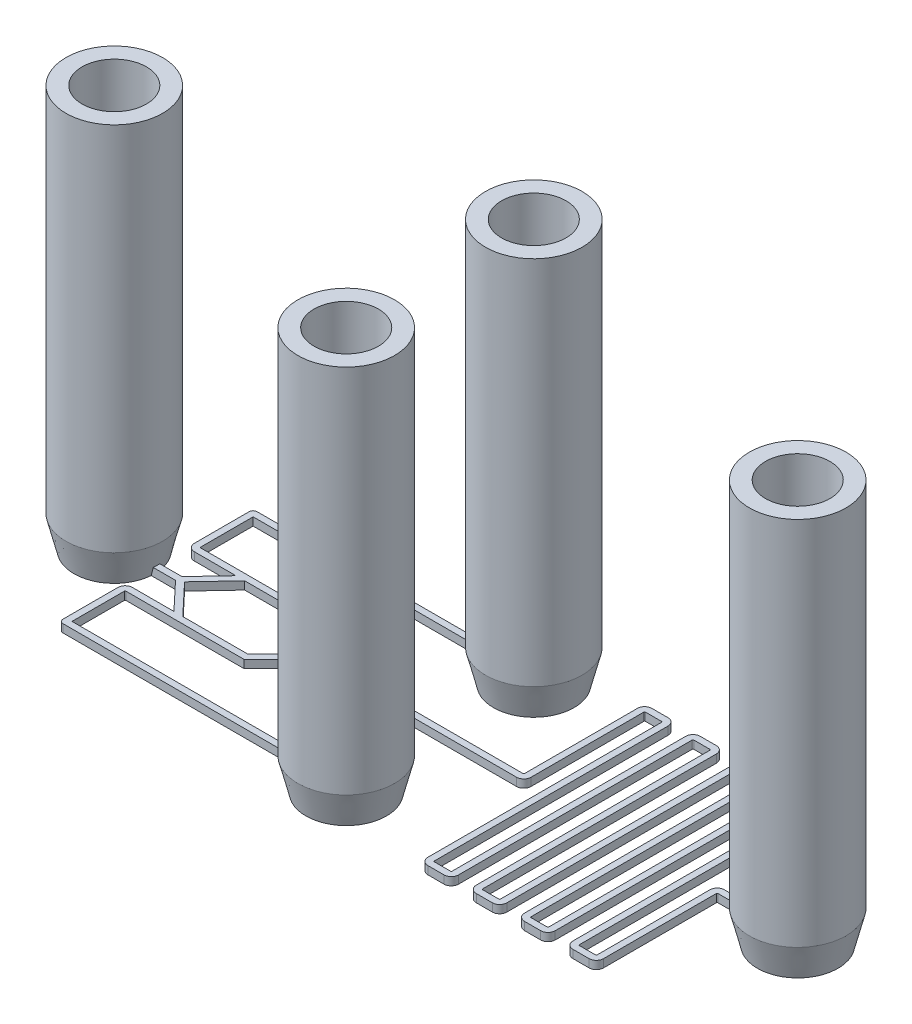
from build123d import *

# Parameters (mm, degrees)
SKELTON_EXTRU_DEPTH = 1
SKETCH8_R           = 4
CUT_EXTRUDE1_DEPTH  = 45


with BuildPart() as part:
    # Sketch2 → skelton_extru (new body)
    with BuildSketch(Plane(origin=(0, 0, 0), x_dir=(1, 0, 0), z_dir=(0, 1, 0))):
        with BuildLine():
            Line((-31.842640687, 11.242640687), (2.6, 11.242640687))
            ThreePointArc((2.6, 11.242640687), (3, 11.642640687), (2.6, 12.042640687))
            Line((2.6, 12.042640687), (-31.842640687, 12.042640687))
            Line((-31.842640687, 12.042640687), (-32.142640687, 12.042640687))
            ThreePointArc((-32.142640687, 12.042640687), (-32.496194078, 11.896194078), (-32.642640687, 11.542640687))
            Line((-32.642640687, 11.542640687), (-32.642640687, 4.742640687))
            ThreePointArc((-32.642640687, 4.742640687), (-32.37903679, 4.106244584), (-31.742640687, 3.842640687))
            Line((-31.742640687, 3.842640687), (-26.585761453, 3.842640687))
            Line((-26.585761453, 3.842640687), (-29.831514219, 0.4))
            Line((-29.831514219, 0.4), (-37.831514219, 0.4))
            ThreePointArc((-37.831514219, 0.4), (-38.231514219, 0), (-37.831514219, -0.4))
            Line((-37.831514219, -0.4), (-29.831514219, -0.4))
            Line((-29.831514219, -0.4), (-26.585761453, -3.842640687))
            Line((-26.585761453, -3.842640687), (-31.742640687, -3.842640687))
            ThreePointArc((-31.742640687, -3.842640687), (-32.37903679, -4.106244584), (-32.642640687, -4.742640687))
            Line((-32.642640687, -4.742640687), (-32.642640687, -11.542640687))
            ThreePointArc((-32.642640687, -11.542640687), (-32.496194078, -11.896194078), (-32.142640687, -12.042640687))
            Line((-32.142640687, -12.042640687), (-31.842640687, -12.042640687))
            Line((-31.842640687, -12.042640687), (2.6, -12.042640687))
            ThreePointArc((2.6, -12.042640687), (3, -11.642640687), (2.6, -11.242640687))
            Line((2.6, -11.242640687), (-31.842640687, -11.242640687))
            Line((-31.842640687, -11.242640687), (-31.842640687, -4.742640687))
            ThreePointArc((-31.842640687, -4.742640687), (-31.813351365, -4.671930009), (-31.742640687, -4.642640687))
            Line((-31.742640687, -4.642640687), (-17.076955262, -4.642640687))
            Line((-17.076955262, -4.642640687), (-12.834314575, -0.4))
            Line((-12.834314575, -0.4), (6.7, -0.4))
            Line((6.7, -0.4), (12.5, -0.4))
            ThreePointArc((12.5, -0.4), (13.136396103, -0.136396103), (13.4, 0.5))
            Line((13.4, 0.5), (13.4, 14.5))
            ThreePointArc((13.4, 14.5), (13.429289322, 14.570710678), (13.5, 14.6))
            Line((13.5, 14.6), (15.5, 14.6))
            ThreePointArc((15.5, 14.6), (15.570710678, 14.570710678), (15.6, 14.5))
            Line((15.6, 14.5), (15.6, 0))
            Line((15.6, 0), (15.6, -14.5))
            ThreePointArc((15.6, -14.5), (15.863603897, -15.136396103), (16.5, -15.4))
            Line((16.5, -15.4), (18.5, -15.4))
            ThreePointArc((18.5, -15.4), (19.136396103, -15.136396103), (19.4, -14.5))
            Line((19.4, -14.5), (19.4, 14.5))
            ThreePointArc((19.4, 14.5), (19.429289322, 14.570710678), (19.5, 14.6))
            Line((19.5, 14.6), (21.5, 14.6))
            ThreePointArc((21.5, 14.6), (21.570710678, 14.570710678), (21.6, 14.5))
            Line((21.6, 14.5), (21.6, -14.5))
            ThreePointArc((21.6, -14.5), (21.863603897, -15.136396103), (22.5, -15.4))
            Line((22.5, -15.4), (24.5, -15.4))
            ThreePointArc((24.5, -15.4), (25.136396103, -15.136396103), (25.4, -14.5))
            Line((25.4, -14.5), (25.4, 14.5))
            ThreePointArc((25.4, 14.5), (25.429289322, 14.570710678), (25.5, 14.6))
            Line((25.5, 14.6), (27.5, 14.6))
            ThreePointArc((27.5, 14.6), (27.570710678, 14.570710678), (27.6, 14.5))
            Line((27.6, 14.5), (27.6, -14.5))
            ThreePointArc((27.6, -14.5), (27.863603897, -15.136396103), (28.5, -15.4))
            Line((28.5, -15.4), (30.5, -15.4))
            ThreePointArc((30.5, -15.4), (31.136396103, -15.136396103), (31.4, -14.5))
            Line((31.4, -14.5), (31.4, 14.5))
            ThreePointArc((31.4, 14.5), (31.429289322, 14.570710678), (31.5, 14.6))
            Line((31.5, 14.6), (33.5, 14.6))
            ThreePointArc((33.5, 14.6), (33.570710678, 14.570710678), (33.6, 14.5))
            Line((33.6, 14.5), (33.6, -14.5))
            ThreePointArc((33.6, -14.5), (33.863603897, -15.136396103), (34.5, -15.4))
            Line((34.5, -15.4), (36.5, -15.4))
            ThreePointArc((36.5, -15.4), (37.136396103, -15.136396103), (37.4, -14.5))
            Line((37.4, -14.5), (37.4, -0.5))
            ThreePointArc((37.4, -0.5), (37.429289322, -0.429289322), (37.5, -0.4))
            Line((37.5, -0.4), (47, -0.4))
            ThreePointArc((47, -0.4), (47.4, 0), (47, 0.4))
            Line((47, 0.4), (37.5, 0.4))
            ThreePointArc((37.5, 0.4), (36.863603897, 0.136396103), (36.6, -0.5))
            Line((36.6, -0.5), (36.6, -14.5))
            ThreePointArc((36.6, -14.5), (36.570710678, -14.570710678), (36.5, -14.6))
            Line((36.5, -14.6), (34.5, -14.6))
            ThreePointArc((34.5, -14.6), (34.429289322, -14.570710678), (34.4, -14.5))
            Line((34.4, -14.5), (34.4, 14.5))
            ThreePointArc((34.4, 14.5), (34.136396103, 15.136396103), (33.5, 15.4))
            Line((33.5, 15.4), (31.5, 15.4))
            ThreePointArc((31.5, 15.4), (30.863603897, 15.136396103), (30.6, 14.5))
            Line((30.6, 14.5), (30.6, -14.5))
            ThreePointArc((30.6, -14.5), (30.570710678, -14.570710678), (30.5, -14.6))
            Line((30.5, -14.6), (28.5, -14.6))
            ThreePointArc((28.5, -14.6), (28.429289322, -14.570710678), (28.4, -14.5))
            Line((28.4, -14.5), (28.4, 14.5))
            ThreePointArc((28.4, 14.5), (28.136396103, 15.136396103), (27.5, 15.4))
            Line((27.5, 15.4), (25.5, 15.4))
            ThreePointArc((25.5, 15.4), (24.863603897, 15.136396103), (24.6, 14.5))
            Line((24.6, 14.5), (24.6, -14.5))
            ThreePointArc((24.6, -14.5), (24.570710678, -14.570710678), (24.5, -14.6))
            Line((24.5, -14.6), (22.5, -14.6))
            ThreePointArc((22.5, -14.6), (22.429289322, -14.570710678), (22.4, -14.5))
            Line((22.4, -14.5), (22.4, 14.5))
            ThreePointArc((22.4, 14.5), (22.136396103, 15.136396103), (21.5, 15.4))
            Line((21.5, 15.4), (19.5, 15.4))
            ThreePointArc((19.5, 15.4), (18.863603897, 15.136396103), (18.6, 14.5))
            Line((18.6, 14.5), (18.6, -14.5))
            ThreePointArc((18.6, -14.5), (18.570710678, -14.570710678), (18.5, -14.6))
            Line((18.5, -14.6), (16.5, -14.6))
            ThreePointArc((16.5, -14.6), (16.429289322, -14.570710678), (16.4, -14.5))
            Line((16.4, -14.5), (16.4, 0))
            Line((16.4, 0), (16.4, 14.5))
            ThreePointArc((16.4, 14.5), (16.136396103, 15.136396103), (15.5, 15.4))
            Line((15.5, 15.4), (13.5, 15.4))
            ThreePointArc((13.5, 15.4), (12.863603897, 15.136396103), (12.6, 14.5))
            Line((12.6, 14.5), (12.6, 0.5))
            ThreePointArc((12.6, 0.5), (12.570710678, 0.429289322), (12.5, 0.4))
            Line((12.5, 0.4), (6.7, 0.4))
            Line((6.7, 0.4), (-12.834314575, 0.4))
            Line((-12.834314575, 0.4), (-17.076955262, 4.642640687))
            Line((-17.076955262, 4.642640687), (-31.742640687, 4.642640687))
            ThreePointArc((-31.742640687, 4.642640687), (-31.813351365, 4.671930009), (-31.842640687, 4.742640687))
            Line((-31.842640687, 4.742640687), (-31.842640687, 11.242640687))
        make_face()
        Polygon((-13.565685425, 0), (-17.408326112, -3.842640687), (-25.486266619, -3.842640687), (-29.109143003, 0), (-25.486266619, 3.842640687), (-17.408326112, 3.842640687), align=None, mode=Mode.SUBTRACT)
    extrude(amount=SKELTON_EXTRU_DEPTH)

    # Sketch3 → Revolve1 (revolve)
    with BuildSketch(Plane.XY.offset(-11.642640687), mode=Mode.PRIVATE) as revolve1_sk:
        Polygon((2.6, 0), (7.6, 0), (8.6, 4), (8.6, 50), (2.6, 50), align=None)
    revolve(revolve1_sk.sketch.rotate(Axis((2.6, 0, -11.642640687), (0, 1, 0)), 184.588565502), axis=Axis((2.6, 0, -11.642640687), (0, 1, 0)))

    # Sketch4 → Revolve2 (revolve)
    with BuildSketch(Plane(origin=(0, 0, 0), x_dir=(-1, 0, 0), z_dir=(0, 0, -1)), mode=Mode.PRIVATE) as revolve2_sk:
        Polygon((-47, 0), (-52, 0), (-53, 4), (-53, 50), (-47, 50), align=None)
    revolve(revolve2_sk.sketch.rotate(Axis((47, 0, 0), (0, 1, 0)), 184.588558424), axis=Axis((47, 0, 0), (0, 1, 0)))

    # Sketch5 → Revolve3 (revolve)
    with BuildSketch(Plane(origin=(0, 0, 0), x_dir=(-1, 0, 0), z_dir=(0, 0, -1))):
        Polygon((37.831514219, 50), (37.831514219, 0), (42.831514219, 0), (43.831514219, 4), (43.831514219, 50), align=None)
    revolve(axis=Axis((-37.831514219, 50, 0), (0, -1, 0)))

    # Sketch6 → Revolve4 (revolve)
    with BuildSketch(Plane.XY.offset(11.642640687), mode=Mode.PRIVATE) as revolve4_sk:
        Polygon((2.6, 0), (7.6, 0), (8.6, 4), (8.6, 50), (2.6, 50), align=None)
    revolve(revolve4_sk.sketch.rotate(Axis((2.6, 0, 11.642640687), (0, 1, 0)), 184.588565502), axis=Axis((2.6, 0, 11.642640687), (0, 1, 0)))

    # Sketch8 → Cut-Extrude1 (cut)
    with BuildSketch(Plane(origin=(0, 50, 0), x_dir=(1, 0, 0), z_dir=(0, 1, 0))):
        with Locations(Location((-37.831514219, 0, 0), (0, 0, 180))):
            Circle(SKETCH8_R)
        with Locations(Location((2.6, 11.642640687, 0), (0, 0, 180))):
            Circle(SKETCH8_R)
        with Locations(Location((2.6, -11.642640687, 0), (0, 0, 180))):
            Circle(SKETCH8_R)
        with Locations(Location((47, 0, 0), (0, 0, 180))):
            Circle(SKETCH8_R)
    extrude(amount=-CUT_EXTRUDE1_DEPTH, mode=Mode.SUBTRACT)


solid = part.part
